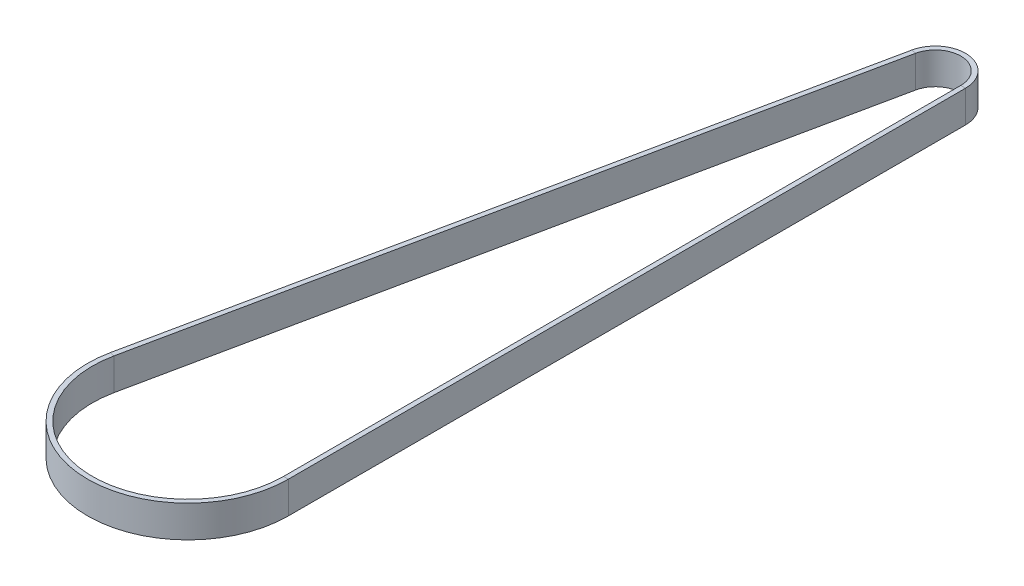
from build123d import *

# Parameters (mm, degrees)
SKETCH_3_W = 1.5
SKETCH_3_H = 10


with BuildPart() as part:
    # 扫描1: sweep along a path in 草图2
    with BuildLine(Plane(origin=(0, 0, 0), x_dir=(1, 0, 0), z_dir=(0, 1, 0))) as sweep_1_path:
        Line((8, -212.5), (8, 0))
        ThreePointArc((8, 0), (0.823832006, 7.957468242), (-7.830325206, 1.638904257))
        Line((-7.830325206, 1.638904257), (-51.363719524, -206.354109038))
        ThreePointArc((-51.363719524, -206.354109038), (-25.089370023, -242.340505908), (8, -212.5))
    # 草图3 → 扫描1 (sweep)
    with BuildSketch(Plane.XY):
        with Locations((8.75, 5)):
            Rectangle(SKETCH_3_W, SKETCH_3_H)
    sweep(path=sweep_1_path.line)


solid = part.part
